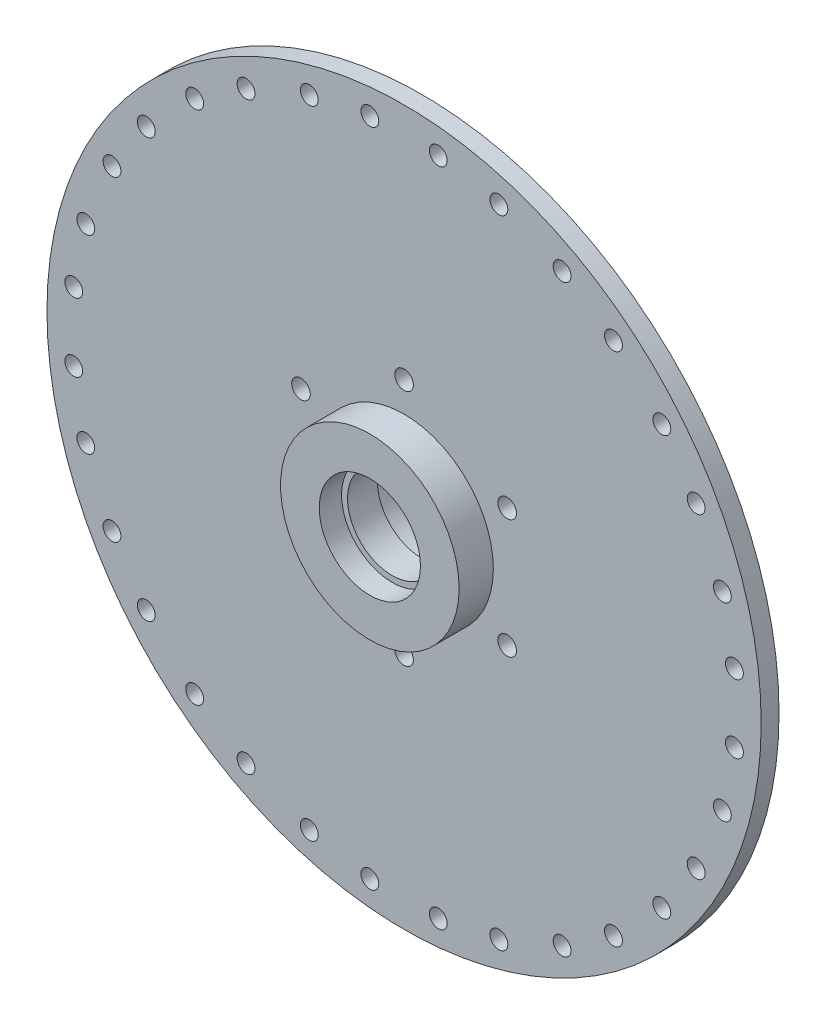
from build123d import *

# Parameters (mm, degrees)
SCHIZZO1_R                   = 240
SCHIZZO1_R_2                 = 6.25
ESTRUSIONE_ESTRUSIONE1_DEPTH = 12
SCHIZZO2_R                   = 60
ESTRUSIONE_ESTRUSIONE2_DEPTH = 23
SCHIZZO3_R                   = 67.5
ESTRUSIONE_ESTRUSIONE3_DEPTH = 15
SCHIZZO4_R                   = 34
TAGLIO_ESTRUSIONE1_DEPTH     = 15
SCHIZZO5_R                   = 30
TAGLIO_ESTRUSIONE2_DEPTH     = 20
TAGLIO_ESTRUSIONE3_START     = -15
SCHIZZO6_R                   = 34
TAGLIO_ESTRUSIONE3_DEPTH     = 15
SCHIZZO7_R                   = 6
TAGLIO_ESTRUSIONE4_DEPTH     = 12
RIPETIZIONECIRCOLARE1_COUNT  = 16


with BuildPart() as part:
    # Schizzo1 → Estrusione-Estrusione1 (new body)
    with BuildSketch(Plane.XY):
        Circle(SCHIZZO1_R)
        with Locations((0, 80)):
            Circle(SCHIZZO1_R_2, mode=Mode.SUBTRACT)
        with Locations((69.282032303, 40)):
            Circle(SCHIZZO1_R_2, mode=Mode.SUBTRACT)
        with Locations((69.282032303, -40)):
            Circle(SCHIZZO1_R_2, mode=Mode.SUBTRACT)
        with Locations((0, -80)):
            Circle(SCHIZZO1_R_2, mode=Mode.SUBTRACT)
        with Locations((-69.282032303, -40)):
            Circle(SCHIZZO1_R_2, mode=Mode.SUBTRACT)
        with Locations((-69.282032303, 40)):
            Circle(SCHIZZO1_R_2, mode=Mode.SUBTRACT)
    extrude(amount=ESTRUSIONE_ESTRUSIONE1_DEPTH)

    # Schizzo2 → Estrusione-Estrusione2 (add)
    with BuildSketch(Plane.XY.offset(12)):
        Circle(SCHIZZO2_R)
    extrude(amount=ESTRUSIONE_ESTRUSIONE2_DEPTH)

    # Schizzo3 → Estrusione-Estrusione3 (add)
    with BuildSketch(Plane(origin=(0, 0, 0), x_dir=(-1, 0, 0), z_dir=(0, 0, -1))):
        with Locations(Location((0, 0, 0), (0, 0, 180))):
            Circle(SCHIZZO3_R)
    extrude(amount=ESTRUSIONE_ESTRUSIONE3_DEPTH)

    # Schizzo4 → Taglio-Estrusione1 (cut)
    with BuildSketch(Plane.XY.offset(35)):
        Circle(SCHIZZO4_R)
    extrude(amount=-TAGLIO_ESTRUSIONE1_DEPTH, mode=Mode.SUBTRACT)

    # Schizzo5 → Taglio-Estrusione2 (cut)
    with BuildSketch(Plane.XY.offset(20)):
        Circle(SCHIZZO5_R)
    extrude(amount=-TAGLIO_ESTRUSIONE2_DEPTH, mode=Mode.SUBTRACT)

    # Schizzo6 → Taglio-Estrusione3 (cut)
    with BuildSketch(Plane(origin=(0, 0, -15), x_dir=(-1, 0, 0), z_dir=(0, 0, -1)).offset(TAGLIO_ESTRUSIONE3_START)):
        with Locations(Location((0, 0, 0), (0, 0, 180))):
            Circle(SCHIZZO6_R)
    extrude(amount=TAGLIO_ESTRUSIONE3_DEPTH, mode=Mode.SUBTRACT)

    # Schizzo7 → Taglio-Estrusione4 (cut)
    with BuildSketch(Plane.XY.offset(12)):
        with Locations((-222, 23)):
            Circle(SCHIZZO7_R)
        with Locations((-222, -23)):
            Circle(SCHIZZO7_R)
    taglio_estrusione4 = extrude(amount=-TAGLIO_ESTRUSIONE4_DEPTH, mode=Mode.SUBTRACT)

    # RipetizioneCircolare1: Taglio-Estrusione4 ×16 about axis
    ripetizionecircolare1_axis = Axis((0, 0, 0), (0, 0, 1))
    for i in range(1, RIPETIZIONECIRCOLARE1_COUNT):
        add(taglio_estrusione4.rotate(ripetizionecircolare1_axis, i * 360 / RIPETIZIONECIRCOLARE1_COUNT), mode=Mode.SUBTRACT)


solid = part.part
